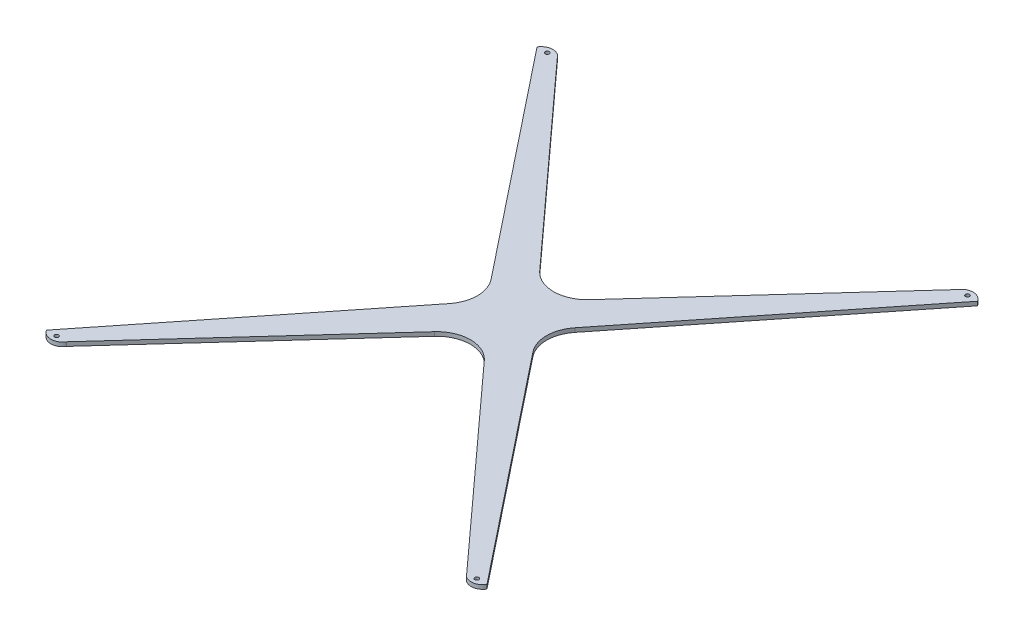
from build123d import *

# Parameters (mm, degrees)
SKETCH1_R           = 6
BOSS_EXTRUDE1_DEPTH = 12
FILLET1_R           = 100


with BuildPart() as part:
    # Sketch1 → Boss-Extrude1 (new body)
    with BuildSketch(Plane(origin=(0, 0, 0), x_dir=(1, 0, 0), z_dir=(0, 1, 0))):
        with BuildLine():
            Line((550, 729.5), (-30, 1459))
            ThreePointArc((-30, 1459), (0, 1476), (30, 1459))
            Line((30, 1459), (625, 804.5))
            Line((625, 804.5), (1220, 1459))
            ThreePointArc((1220, 1459), (1250, 1476), (1280, 1459))
            Line((1280, 1459), (700, 729.5))
            Line((700, 729.5), (1280, 0))
            ThreePointArc((1280, 0), (1250, -17), (1220, 0))
            Line((1220, 0), (625, 654.5))
            Line((625, 654.5), (30, 0))
            ThreePointArc((30, 0), (0, -17), (-30, 0))
            Line((-30, 0), (550, 729.5))
        make_face()
        with Locations(Location((0, 1459, 0), (0, 0, 270))):
            Circle(SKETCH1_R, mode=Mode.SUBTRACT)
        with Locations(Location((1250, 1459, 0), (0, 0, 270))):
            Circle(SKETCH1_R, mode=Mode.SUBTRACT)
        with Locations(Location((1250, 0, 0), (0, 0, 270))):
            Circle(SKETCH1_R, mode=Mode.SUBTRACT)
        with Locations(Location((0, 0, 0), (0, 0, 270))):
            Circle(SKETCH1_R, mode=Mode.SUBTRACT)
    extrude(amount=BOSS_EXTRUDE1_DEPTH)

    # Fillet1
    fillet1_edges = [part.edges().sort_by_distance(p)[0] for p in [
        (625, 6, -804.5),
        (700, 6, -729.5),
        (625, 6, -654.5),
        (550, 6, -729.5),
    ]]
    fillet(fillet1_edges, radius=FILLET1_R)


solid = part.part
